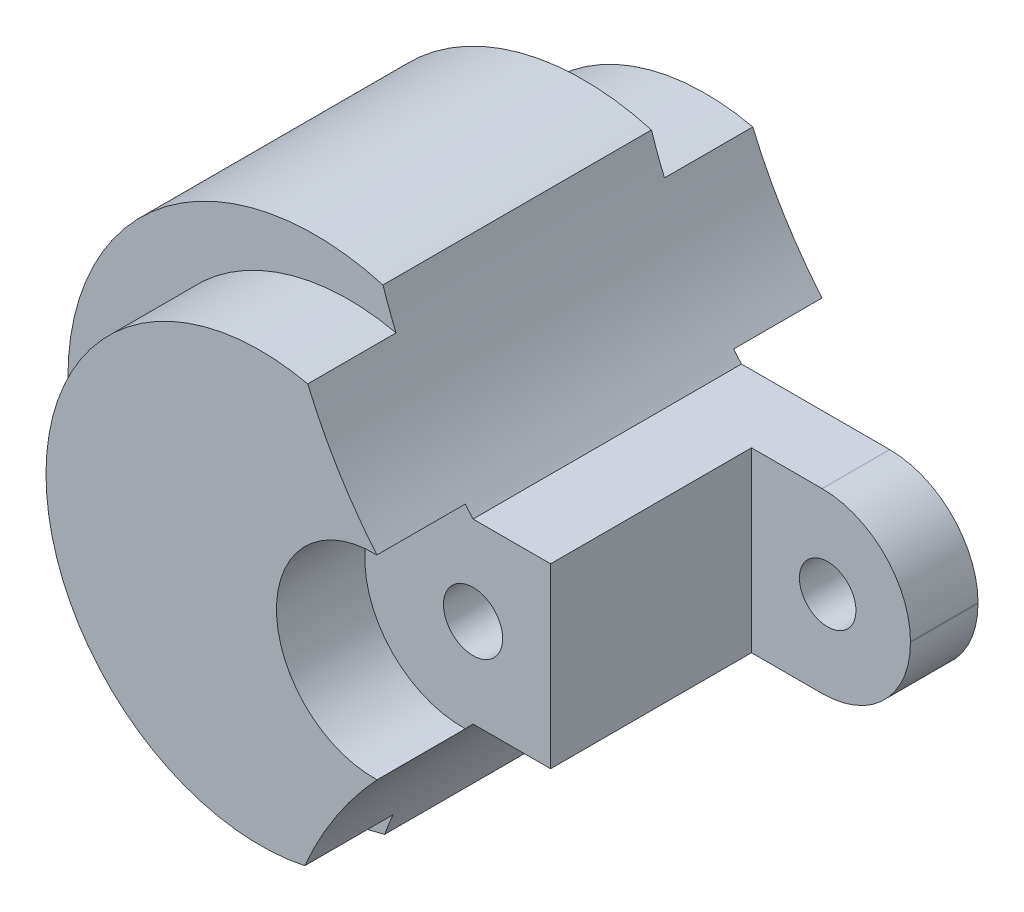
from build123d import *

# Parameters (mm, degrees)
EXTRUDE_1_DEPTH      = 2.2
EXTRUDE_2_DEPTH      = 3.25
SKETCH_3_W           = 50
SKETCH_3_H           = 10.05
EXTRUDE_3_DEPTH      = 3.25
CUT_EXTRUDE_1_DEPTH  = 30
EXTRUDE_4_REACH      = 56.389
SKETCH_6_R           = 5.025
SKETCH_8_R           = 1.675
SKETCH_8_R_2         = 0.84
CUT_EXTRUDE_3_DEPTH  = 55
SKETCH_9_W           = 28.473000816
SKETCH_9_H           = 14.532409192
CUT_EXTRUDE_4_DEPTH  = 3
EXTRUDE_5_DEPTH      = 2.45
SKETCH_11_W          = 12.614203935
SKETCH_11_H          = 10.05
EXTRUDE_6_DEPTH      = 3
SKETCH_12_W          = 36.628466797
SKETCH_12_H          = 15.348537224
CUT_EXTRUDE_5_DEPTH  = 10
SKETCH_13_W          = 5.35
SKETCH_13_H          = 5.35
CUT_EXTRUDE_6_DEPTH  = 14
SKETCH_14_R          = 1.1
CUT_EXTRUDE_7_DEPTH  = 14
SKETCH_15_R          = 1.1
CUT_EXTRUDE_8_DEPTH  = 10
SKETCH_16_R          = 1.625
EXTRUDE_7_DEPTH      = 5.7
SKETCH_17_W          = 19.923143876
SKETCH_17_H          = 15.083058075
CUT_EXTRUDE_9_DEPTH  = 3
SKETCH_18_R          = 1.675
SKETCH_18_R_2        = 1.6
CUT_EXTRUDE_10_DEPTH = 6
CUT_EXTRUDE_11_DEPTH = 10
EXTRUDE_8_DEPTH      = 9.5
EXTRUDE_9_DEPTH      = 15.2
SKETCH_23_W          = 14.793785908
SKETCH_23_H          = 11.59723546
CUT_EXTRUDE_12_DEPTH = 9
SKETCH_25_R          = 1.6
SKETCH_25_R_2        = 1.673969756
CUT_EXTRUDE_13_DEPTH = 20
FILLET_1_R           = 5
EXTRUDE_START        = 5
EXTRUDE_10_DEPTH     = 5
EXTRUDE_11_DEPTH     = 25.2


with BuildPart() as part:
    # 草图1 → 凸台-拉伸1 (new body)
    with BuildSketch(Plane.XY):
        with BuildLine():
            Line((1.539836705, 12.851012384), (15.55297303, 14.251012384))
            ThreePointArc((15.55297303, 14.251012384), (17.193415997, 16.063512384), (15.55297303, 17.876012384))
            Line((15.55297303, 17.876012384), (1.500532553, 18.901012384))
            ThreePointArc((1.500532553, 18.901012384), (0.527100583, 19.384612538), (-0.54702697, 19.551012384))
            Line((-0.54702697, 19.551012384), (-0.54702697, 20.901012384))
            Line((-0.54702697, 20.901012384), (19.51277613, 20.901012384))
            Line((19.51277613, 20.901012384), (41.45297303, 20.901012384))
            Line((41.45297303, 20.901012384), (41.45297303, 10.851012384))
            Line((41.45297303, 10.851012384), (-0.54702697, 10.851012384))
            Line((-0.54702697, 10.851012384), (-0.54702697, 12.201012384))
            ThreePointArc((-0.54702697, 12.201012384), (0.54584768, 12.367273294), (1.539836705, 12.851012384))
        make_face()
    extrude(amount=EXTRUDE_1_DEPTH)

    # 草图2 → 凸台-拉伸2 (add)
    with BuildSketch(Plane(origin=(0, 0, 0), x_dir=(-1, 0, 0), z_dir=(0, 0, -1))):
        Polygon((-19.51277613, 10.851012384), (-49.45297303, 10.851012384), (-49.45297303, 20.901012384), (-19.51277613, 20.901012384), (0.54702697, 20.901012384), (0.54702697, 10.851012384), align=None)
    extrude(amount=EXTRUDE_2_DEPTH)

    # 草图3 → 凸台-拉伸3 (add)
    with BuildSketch(Plane.XY.offset(2.2)):
        with Locations((24.45297303, 15.876012384)):
            Rectangle(SKETCH_3_W, SKETCH_3_H)
    extrude(amount=EXTRUDE_3_DEPTH)

    # 草图4 → 切除-拉伸1 (cut, symmetric)
    with BuildSketch(Plane.XY):
        with BuildLine():
            Line((-0.54702697, 19.551012384), (-2.235397712, 16.616091152))
            Line((-2.235397712, 16.616091152), (-1.110896638, 12.310548833))
            Line((-1.110896638, 12.310548833), (-0.54702697, 12.201012384))
            ThreePointArc((-0.54702697, 12.201012384), (0.54584768, 12.367273294), (1.539836705, 12.851012384))
            ThreePointArc((1.539836705, 12.851012384), (2.773180655, 15.88415254), (1.500532553, 18.901012384))
            ThreePointArc((1.500532553, 18.901012384), (0.527100583, 19.384612538), (-0.54702697, 19.551012384))
        make_face()
    extrude(amount=CUT_EXTRUDE_1_DEPTH, both=True, mode=Mode.SUBTRACT)

    # 凸台-拉伸4: up to this face of the body (flat: up to its plane)
    extrude_4_end = Plane(part.part.faces().sort_by_distance((25.407741746, 15.876338503, 5.45))[0])
    # 草图6 → 凸台-拉伸4 (add, up to the picked face)
    with BuildSketch(Plane(origin=(0, 0, -3.25), x_dir=(-1, 0, 0), z_dir=(0, 0, -1)), mode=Mode.PRIVATE) as extrude_4_sk1:
        with Locations(Location((-49.45297303, 15.876012384, 0), (0, 0, 90))):
            Circle(SKETCH_6_R)
    extrude_4_tool1 = split(extrude(extrude_4_sk1.sketch, amount=-EXTRUDE_4_REACH, mode=Mode.PRIVATE), bisect_by=extrude_4_end, keep=Keep.BOTH, mode=Mode.PRIVATE)
    add(extrude_4_tool1.solids().sort_by(Axis((49.452973, 15.876012, -3.25), (0, 0, 1)))[0])

    # 草图8 → 切除-拉伸3 (cut)
    with BuildSketch(Plane(origin=(0, 0, -3.25), x_dir=(-1, 0, 0), z_dir=(0, 0, -1))):
        with Locations((-49.45297303, 15.876012384)):
            Circle(SKETCH_8_R)
        with Locations(Location((-7.95297303, 15.856360308, 0), (0, 0, 180))):
            Circle(SKETCH_8_R_2)
    extrude(amount=-CUT_EXTRUDE_3_DEPTH, mode=Mode.SUBTRACT)

    # 草图9 → 切除-拉伸4 (cut)
    with BuildSketch(Plane(origin=(0, 0, -3.25), x_dir=(-1, 0, 0), z_dir=(0, 0, -1))):
        with Locations((-42.648638606, 15.039406696)):
            Rectangle(SKETCH_9_W, SKETCH_9_H)
    extrude(amount=-CUT_EXTRUDE_4_DEPTH, mode=Mode.SUBTRACT)

    # 草图10 → 凸台-拉伸5 (add)
    with BuildSketch(Plane(origin=(0, 0, 2.2), x_dir=(-1, 0, 0), z_dir=(0, 0, -1))):
        with BuildLine():
            Line((-49.45297303, 20.901012384), (-38.466384114, 20.901012384))
            Line((-38.466384114, 20.901012384), (-38.466384114, 10.851012384))
            Line((-38.466384114, 10.851012384), (-49.45297303, 10.851012384))
            ThreePointArc((-49.45297303, 10.851012384), (-46.217908976, 15.876012384), (-49.45297303, 20.901012384))
        make_face()
    extrude(amount=EXTRUDE_5_DEPTH)

    # 草图11 → 凸台-拉伸6 (add)
    with BuildSketch(Plane(origin=(0, 0, -3.25), x_dir=(-1, 0, 0), z_dir=(0, 0, -1))):
        with Locations((-32.625453647, 15.876012384)):
            Rectangle(SKETCH_11_W, SKETCH_11_H)
    extrude(amount=-EXTRUDE_6_DEPTH)

    # 草图12 → 切除-拉伸5 (cut)
    with BuildSketch(Plane(origin=(0, 0, -3.25), x_dir=(-1, 0, 0), z_dir=(0, 0, -1))):
        with Locations((-5.618322216, 15.103365543)):
            Rectangle(SKETCH_12_W, SKETCH_12_H)
    extrude(amount=-CUT_EXTRUDE_5_DEPTH, mode=Mode.SUBTRACT)

    # 草图13 → 切除-拉伸6 (cut)
    with BuildSketch(Plane.ZY.offset(-23.932555614)):
        with Locations((1.1, 16.124405573)):
            Rectangle(SKETCH_13_W, SKETCH_13_H)
    extrude(amount=-CUT_EXTRUDE_6_DEPTH, mode=Mode.SUBTRACT)

    # 草图14 → 切除-拉伸7 (cut)
    with BuildSketch(Plane(origin=(0, 20.901012384, 0), x_dir=(1, 0, 0), z_dir=(0, 1, 0))):
        with Locations(Location((30.538219594, -1.1, 0), (0, 0, 270))):
            Circle(SKETCH_14_R)
    extrude(amount=-CUT_EXTRUDE_7_DEPTH, mode=Mode.SUBTRACT)

    # 草图15 → 切除-拉伸8 (cut)
    with BuildSketch(Plane.XY.offset(5.45)):
        with Locations((36.879929969, 15.882801083)):
            Circle(SKETCH_15_R)
    extrude(amount=-CUT_EXTRUDE_8_DEPTH, mode=Mode.SUBTRACT)

    # 草图16 → 凸台-拉伸7 (add)
    with BuildSketch(Plane(origin=(0, 0, -0.25), x_dir=(-1, 0, 0), z_dir=(0, 0, -1))):
        with BuildLine():
            Line((-49.45297303, 20.901012384), (23.54702697, 20.901012384))
            ThreePointArc((23.54702697, 20.901012384), (28.57202697, 15.876012384), (23.54702697, 10.851012384))
            Line((23.54702697, 10.851012384), (-49.45297303, 10.851012384))
            Line((-49.45297303, 10.851012384), (-49.45297303, 20.901012384))
        make_face()
        with Locations((23.54702697, 15.876012384)):
            Circle(SKETCH_16_R, mode=Mode.SUBTRACT)
    extrude(amount=-EXTRUDE_7_DEPTH)

    # 草图17 → 切除-拉伸9 (cut)
    with BuildSketch(Plane(origin=(0, 0, -3.25), x_dir=(-1, 0, 0), z_dir=(0, 0, -1))):
        with Locations((-33.178239607, 16.007261263)):
            Rectangle(SKETCH_17_W, SKETCH_17_H)
    extrude(amount=-CUT_EXTRUDE_9_DEPTH, mode=Mode.SUBTRACT)

    # 草图18 → 切除-拉伸10 (cut)
    with BuildSketch(Plane(origin=(0, 0, -0.25), x_dir=(-1, 0, 0), z_dir=(0, 0, -1))):
        with Locations(Location((-49.45297303, 15.876012384, 0), (0, 0, 180))):
            Circle(SKETCH_18_R)
        with Locations((14.84318256, 15.876012384)):
            Circle(SKETCH_18_R_2)
        with BuildLine():
            Line((-31.661597205, 17.303258867), (8.461046927, 17.303258867))
            ThreePointArc((8.461046927, 17.303258867), (9.88829341, 15.876012384), (8.461046927, 14.448765901))
            Line((8.461046927, 14.448765901), (-31.661597205, 14.448765901))
            ThreePointArc((-31.661597205, 14.448765901), (-33.088843687, 15.876012384), (-31.661597205, 17.303258867))
        make_face()
    extrude(amount=-CUT_EXTRUDE_10_DEPTH, mode=Mode.SUBTRACT)

    # 草图19 → 切除-拉伸11 (cut)
    with BuildSketch(Plane(origin=(0, 0, -0.25), x_dir=(-1, 0, 0), z_dir=(0, 0, -1))):
        Polygon((12.697516125, 20.901012384), (-60.999534113, 39.375054119), (-58.738783937, -10.22846445), (12.697516125, 10.851012384), (10.156545193, 10.851012384), (10.156545193, 20.901012384), align=None)
    extrude(amount=-CUT_EXTRUDE_11_DEPTH, mode=Mode.SUBTRACT)

    # 草图21 → 凸台-拉伸8 (add)
    with BuildSketch(Plane.XY.offset(5.45)):
        with BuildLine():
            Line((-23.54702697, 20.901012384), (-12.697516125, 20.901012384))
            ThreePointArc((-12.697516125, 20.901012384), (-9.87974938, 15.876012384), (-12.697516125, 10.851012384))
            Line((-12.697516125, 10.851012384), (-23.54702697, 10.851012384))
            ThreePointArc((-23.54702697, 10.851012384), (-28.57202697, 15.876012384), (-23.54702697, 20.901012384))
        make_face()
    extrude(amount=EXTRUDE_8_DEPTH)

    # 草图22 → 凸台-拉伸9 (add)
    with BuildSketch(Plane(origin=(0, 0, -0.25), x_dir=(-1, 0, 0), z_dir=(0, 0, -1))):
        with BuildLine():
            Line((23.54702697, 20.901012384), (26.601137036, 16.368267617))
            Line((26.601137036, 16.368267617), (23.54702697, 10.851012384))
            ThreePointArc((23.54702697, 10.851012384), (26.480521945, 7.163010653), (28.555320944, 2.931940027))
            ThreePointArc((28.555320944, 2.931940027), (46.487809448, 16.320719833), (28.64667794, 29.830997223))
            ThreePointArc((28.64667794, 29.830997223), (26.554002303, 25.104940008), (23.54702697, 20.901012384))
        make_face()
    extrude(amount=-EXTRUDE_9_DEPTH)

    # 草图23 → 切除-拉伸12 (cut, symmetric)
    with BuildSketch(Plane(origin=(-10.156545193, 0, 0), x_dir=(0, 0, -1), z_dir=(1, 0, 0))):
        with Locations((-10.971714959, 15.6975909)):
            Rectangle(SKETCH_23_W, SKETCH_23_H)
    extrude(amount=CUT_EXTRUDE_12_DEPTH, both=True, mode=Mode.SUBTRACT)

    # 草图25 → 切除-拉伸13 (cut)
    with BuildSketch(Plane(origin=(0, 0, -0.25), x_dir=(-1, 0, 0), z_dir=(0, 0, -1))):
        with Locations((14.84318256, 15.876012384)):
            Circle(SKETCH_25_R)
        with Locations((23.54702697, 15.876012384)):
            Circle(SKETCH_25_R_2)
    extrude(amount=-CUT_EXTRUDE_13_DEPTH, mode=Mode.SUBTRACT)

    # 圆角1
    fillet_1_edges = [part.edges().sort_by_distance(p)[0] for p in [
        (-10.156545193, 10.851012384, 1.662411002),
        (-10.156545193, 20.901012384, 1.662411002),
    ]]
    fillet(fillet_1_edges, radius=FILLET_1_R)

    # 草图26 → 凸台-拉伸10 (add)
    with BuildSketch(Plane(origin=(0, 0, -0.25), x_dir=(-1, 0, 0), z_dir=(0, 0, -1)).offset(EXTRUDE_START)):
        with BuildLine():
            ThreePointArc((23.989483385, 21.41624515), (29.677771388, 15.903479456), (23.982335647, 10.398098659))
            ThreePointArc((23.982335647, 10.398098659), (26.300788095, 7.442479058), (28.078905502, 4.133520391))
            ThreePointArc((28.078905502, 4.133520391), (42.727883136, 16.096897132), (27.908169911, 27.848111056))
            ThreePointArc((27.908169911, 27.848111056), (26.188805201, 24.485968475), (23.989483385, 21.41624515))
        make_face()
    extrude(amount=-EXTRUDE_10_DEPTH)

    # 草图27 → 凸台-拉伸11 (add)
    with BuildSketch(Plane(origin=(0, 0, -5.25), x_dir=(-1, 0, 0), z_dir=(0, 0, -1))):
        with BuildLine():
            ThreePointArc((23.989483385, 21.41624515), (29.677771388, 15.903479456), (23.982335647, 10.398098659))
            ThreePointArc((23.982335647, 10.398098659), (26.300788095, 7.442479058), (28.078905502, 4.133520391))
            ThreePointArc((28.078905502, 4.133520391), (42.727883136, 16.096897132), (27.908169911, 27.848111056))
            ThreePointArc((27.908169911, 27.848111056), (26.188805201, 24.485968475), (23.989483385, 21.41624515))
        make_face()
    extrude(amount=-EXTRUDE_11_DEPTH)


solid = part.part
